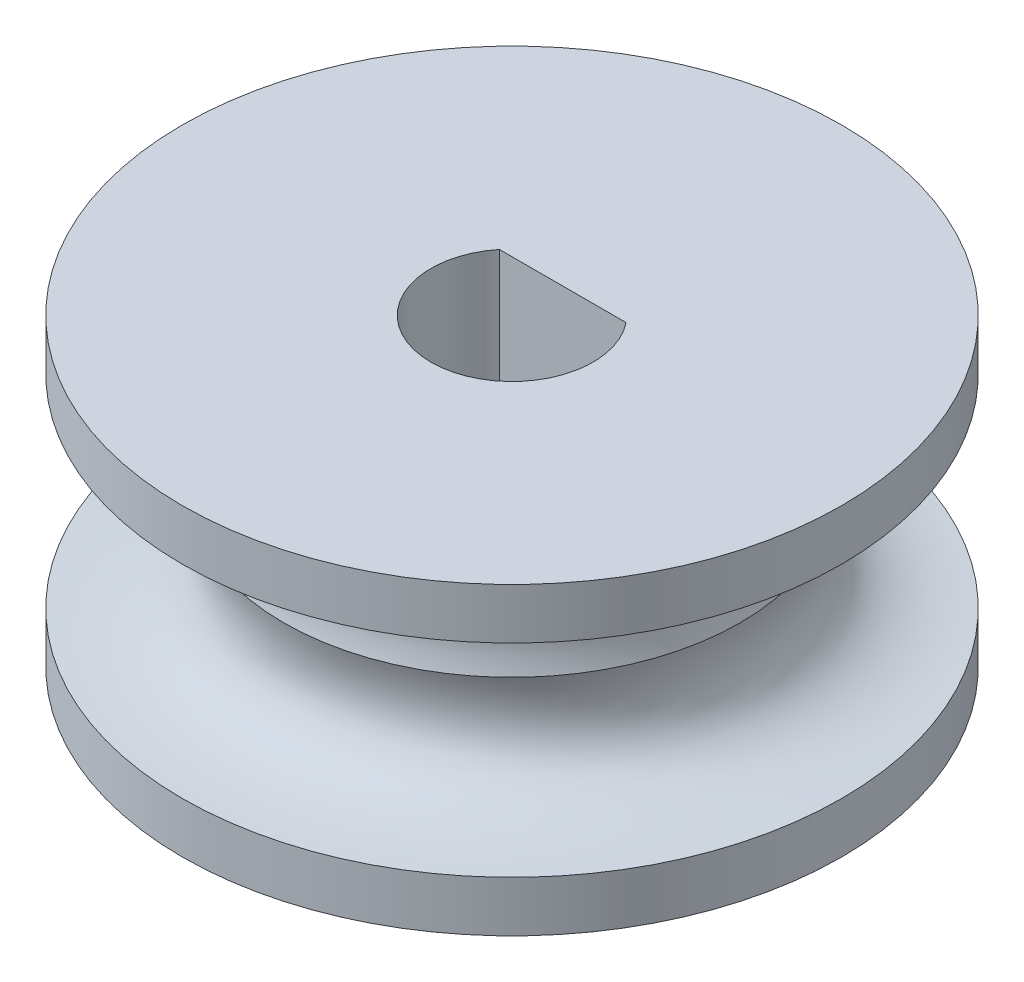
from build123d import *

# Parameters (mm, degrees)
CUT_EXTRUDE1_START = -6
CUT_EXTRUDE1_DEPTH = 17.977249318


with BuildPart() as part:
    # Sketch1 → Revolve1 (revolve)
    with BuildSketch(Plane.XY, mode=Mode.PRIVATE) as revolve1_sk:
        with BuildLine():
            Line((0, 0), (-6.5, 0))
            Line((-6.5, 0), (-6.5, -1))
            add(Edge.make_bspline(
                [(-4.5, -3), (-4.002607285, -1.25459372), (-5.515250155, -1.047243271), (-6.5, -1)],
                knots=[0, 0, 0, 0, 1, 1, 1, 1], degree=3))
            Line((-4.5, -3), (0, -3))
            Line((0, -3), (0, 0))
        make_face()
    revolve1 = revolve(revolve1_sk.sketch.rotate(Axis((0, -3, 0), (0, 1, 0)), 270), axis=Axis((0, -3, 0), (0, 1, 0)))

    # Mirror1: Revolve1 across plane
    add(revolve1.mirror(Plane(origin=(-4.5, -3, 0), x_dir=(0, 0, 1), z_dir=(0, 1, 0))))

    # Sketch2 → Cut-Extrude1 (cut, through all)
    with BuildSketch(Plane(origin=(0, 0, 0), x_dir=(1, 0, 0), z_dir=(0, 1, 0)).offset(CUT_EXTRUDE1_START)):
        with BuildLine():
            Line((-1.2489996, 1), (1.2489996, 1))
            ThreePointArc((1.2489996, 1), (0, -1.6), (-1.2489996, 1))
        make_face()
    extrude(amount=CUT_EXTRUDE1_DEPTH, mode=Mode.SUBTRACT)


solid = part.part
